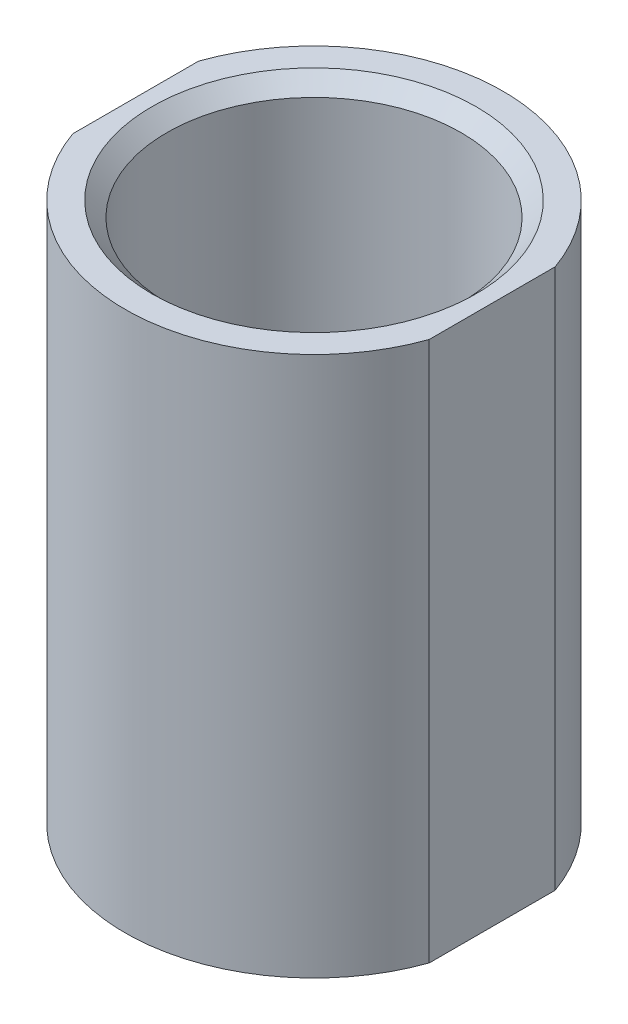
from build123d import *

# Parameters (mm, degrees)
EXTRUDE_2_DEPTH               = 100
HOLE_WIZARD_M60_2_D           = 54.5
HOLE_WIZARD_M60_2_CSINK_D     = 60.05
HOLE_WIZARD_M60_2_CSINK_ANGLE = 90


with BuildPart() as part:
    # 草图1 → 凸台-拉伸2 (new body)
    with BuildSketch(Plane(origin=(0, 0, 0), x_dir=(1, 0, 0), z_dir=(0, 1, 0))):
        with BuildLine():
            ThreePointArc((33, 11.66190379), (0, 35), (-33, 11.66190379))
            Line((-33, 11.66190379), (-33, -11.66190379))
            ThreePointArc((-33, -11.66190379), (0, -35), (33, -11.66190379))
            Line((33, -11.66190379), (33, 11.66190379))
        make_face()
    extrude(amount=EXTRUDE_2_DEPTH)

    # M60 螺纹孔2 (through all)
    with Locations(Plane.ZX.offset(100)):
        with Locations((0, 0)):
            CounterSinkHole(HOLE_WIZARD_M60_2_D / 2, HOLE_WIZARD_M60_2_CSINK_D / 2, counter_sink_angle=HOLE_WIZARD_M60_2_CSINK_ANGLE)


solid = part.part
